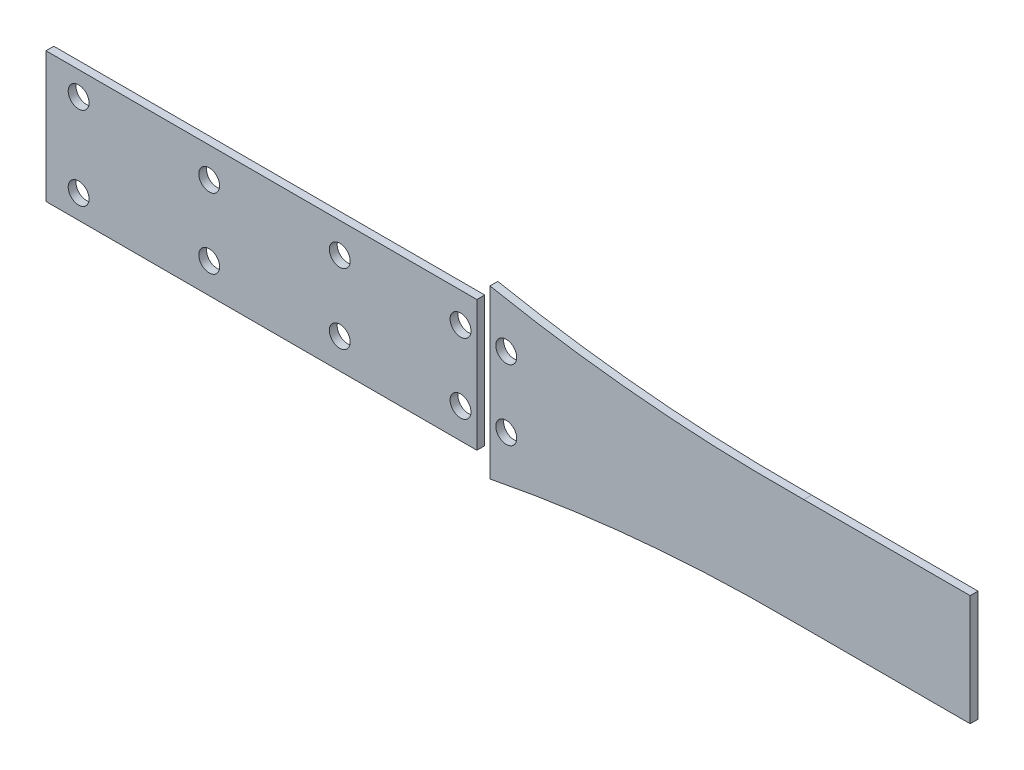
from build123d import *

# Parameters (mm, degrees)
BOSS_EXTRUDE1_DEPTH      = 0.6
BOSS_EXTRUDE1_DEPTH_BACK = 0.6
BOSS_EXTRUDE2_DEPTH      = 0.6
BOSS_EXTRUDE2_DEPTH_BACK = 0.6
SKETCH3_W                = 65.999999997
SKETCH3_H                = 20
SKETCH3_R                = 1.6
CUT_EXTRUDE1_DEPTH       = 211.503888964
CUT_EXTRUDE1_DEPTH_BACK  = 211.503888964
SKETCH4_R                = 1.6


with BuildPart() as part:
    # Sketch2 → Boss-Extrude1 (new, two sides: drawn at the far end of the back side and taken through both)
    with BuildSketch(Plane.XY.offset(-BOSS_EXTRUDE1_DEPTH_BACK)):
        with BuildLine():
            Line((184.174027055, 14.5), (209.661357245, 14.5))
            Line((209.661357245, 14.5), (209.661357245, -2.5))
            Line((209.661357245, -2.5), (184.174027055, -2.5))
            add(Edge.make_bspline(
                [(184.174027055, -2.5), (183.824253427, -2.5), (182.946206391, -2.5), (181.667799963, -2.5), (180.804171148, -2.5), (176.695940371, -2.5), (170.015725267, -2.670138318), (160.683426305, -3.282569394), (151.378685364, -4.272936281), (144.757083805, -5.247503899), (139.459652196, -6.166033814), (137.792001296, -6.473604313), (136.101357245, -6.805384896)],
                knots=[0.04382985, 0.04382985, 0.04382985, 0.04382985, 0.045875996, 0.04917636, 0.052476723, 0.052476723, 0.08232242, 0.112168116, 0.142013813, 0.17185951, 0.17185951, 0.185262545, 0.185262545, 0.185262545, 0.185262545], degree=3))
            Line((136.101357245, -6.805384896), (136.101357245, 18.805384896))
            add(Edge.make_bspline(
                [(184.174027055, 14.5), (183.824253427, 14.5), (182.94620639, 14.5), (181.667799963, 14.5), (180.804171148, 14.5), (176.695940371, 14.5), (170.015725266, 14.670138318), (160.683426305, 15.282569394), (151.378685363, 16.272936281), (144.757083805, 17.247503899), (139.459652196, 18.166033814), (137.792001296, 18.473604313), (136.101357245, 18.805384896)],
                knots=[0.04382985, 0.04382985, 0.04382985, 0.04382985, 0.045875996, 0.04917636, 0.052476723, 0.052476723, 0.08232242, 0.112168116, 0.142013813, 0.17185951, 0.17185951, 0.185262545, 0.185262545, 0.185262545, 0.185262545], degree=3))
        make_face()
    extrude(amount=BOSS_EXTRUDE1_DEPTH + BOSS_EXTRUDE1_DEPTH_BACK)

    # Sketch4 → Cut-Extrude1 (cut, two sides: drawn at the far end of the back side and taken through both)
    with BuildSketch(Plane.XY.offset(-CUT_EXTRUDE1_DEPTH_BACK)):
        with Locations((138.601357245, 11.371281292)):
            Circle(SKETCH4_R)
        with Locations((138.601357245, 0.628718708)):
            Circle(SKETCH4_R)
    extrude(amount=CUT_EXTRUDE1_DEPTH + CUT_EXTRUDE1_DEPTH_BACK, mode=Mode.SUBTRACT)


with BuildPart() as body_2:
    # Sketch3 → Boss-Extrude2 (new, two sides: drawn at the far end of the back side and taken through both)
    with BuildSketch(Plane.XY.offset(-BOSS_EXTRUDE2_DEPTH_BACK)):
        with Locations((101.101357244, 6)):
            Rectangle(SKETCH3_W, SKETCH3_H)
        with Locations((73.101357245, 12.371281292)):
            Circle(SKETCH3_R, mode=Mode.SUBTRACT)
        with Locations((73.101357245, -0.371281292)):
            Circle(SKETCH3_R, mode=Mode.SUBTRACT)
        with Locations((93.101357245, 0.628718708)):
            Circle(SKETCH3_R, mode=Mode.SUBTRACT)
        with Locations((93.101357245, 11.371281292)):
            Circle(SKETCH3_R, mode=Mode.SUBTRACT)
        with Locations((131.601357245, 0.628718708)):
            Circle(SKETCH3_R, mode=Mode.SUBTRACT)
        with Locations((131.601357245, 11.371281292)):
            Circle(SKETCH3_R, mode=Mode.SUBTRACT)
        with Locations((113.101357245, 0.628718708)):
            Circle(SKETCH3_R, mode=Mode.SUBTRACT)
        with Locations((113.101357245, 11.371281292)):
            Circle(SKETCH3_R, mode=Mode.SUBTRACT)
    extrude(amount=BOSS_EXTRUDE2_DEPTH + BOSS_EXTRUDE2_DEPTH_BACK)


solid = Compound([part.part, body_2.part])
